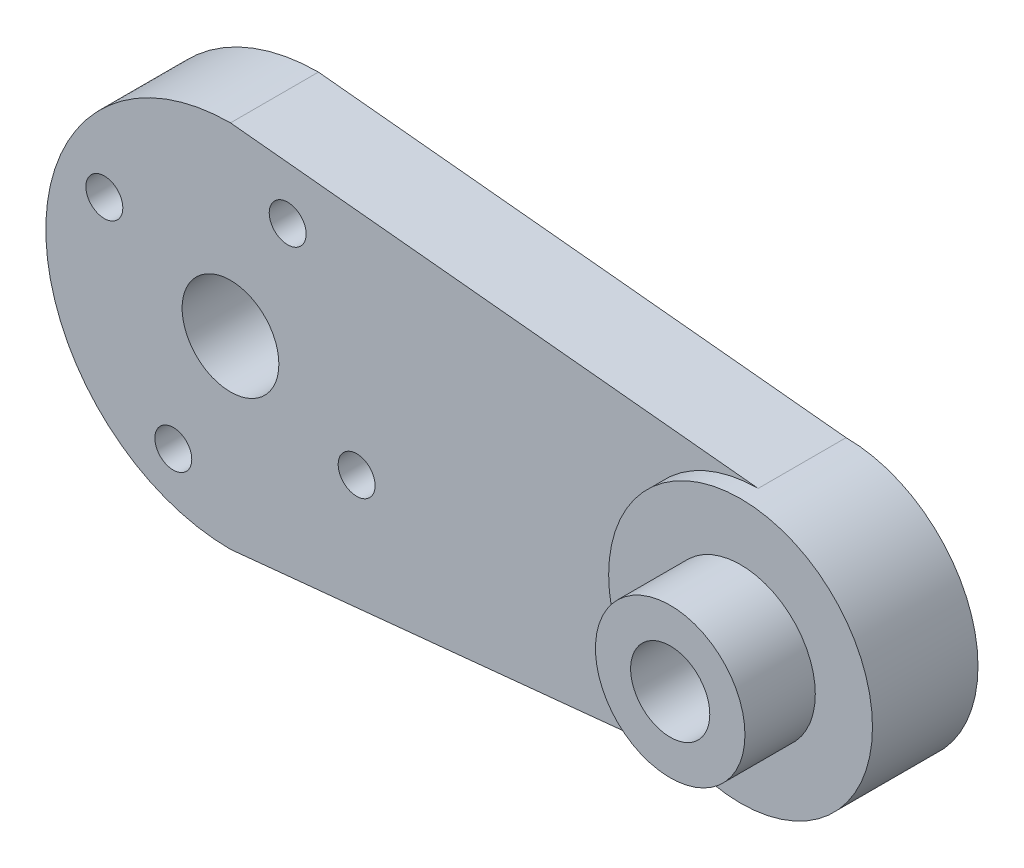
from build123d import *

# Parameters (mm, degrees)
SKETCH_1_R           = 2.75
EXTRUDE_1_DEPTH      = 5
SKETCH_2_R           = 4.250000000000005
EXTRUDE_2_DEPTH      = 5
SKETCH_3_R           = 2.250000000000002
CUT_EXTRUDE_1_DEPTH  = 40.00000000000001
HOLE_WIZARD_M1_8_1_D = 2.1
SKETCH_8_R           = 7.499999999835785
SKETCH_8_R_2         = 2.249999999836049
EXTRUDE_3_DEPTH      = 1


with BuildPart() as part:
    # 스케치1 → 보스-돌출1 (new body)
    with BuildSketch(Plane.XY):
        with BuildLine():
            Line((2.51e-15, 10.5), (30, 7.5))
            ThreePointArc((30, 7.5), (37.5, 0), (30, -7.5))
            Line((30, -7.5), (2.51e-15, -10.5))
            ThreePointArc((2.51e-15, -10.5), (-10.5, 1.29e-15), (2.51e-15, 10.5))
        make_face()
        Circle(SKETCH_1_R, mode=Mode.SUBTRACT)
    extrude(amount=EXTRUDE_1_DEPTH)

    # 스케치2 → 보스-돌출2 (add)
    with BuildSketch(Plane.XY.offset(5)):
        with Locations((30, 0)):
            Circle(SKETCH_2_R)
    extrude(amount=EXTRUDE_2_DEPTH)

    # 스케치3 → 컷-돌출1 (cut)
    with BuildSketch(Plane.XY.offset(10)):
        with Locations((30, 0)):
            Circle(SKETCH_3_R)
    extrude(amount=-CUT_EXTRUDE_1_DEPTH, mode=Mode.SUBTRACT)

    # M1.8 여유 구멍1 (through all)
    with Locations(Plane(origin=(0, 0, 0), x_dir=(-1, 0, 0), z_dir=(0, 0, -1))):
        with Locations((-7.172291773, -3.251754556), (3.251754556, -7.172291774), (7.172291774, 3.251754554), (-3.251754555, 7.172291773)):
            Hole(HOLE_WIZARD_M1_8_1_D / 2)

    # 스케치8 → 보스-돌출3 (add)
    with BuildSketch(Plane.XY.offset(5)):
        with Locations(Location((30.000000000162284, 3.18634e-11, 0), (0, 0, 269.999999996))):
            Circle(SKETCH_8_R)
        with Locations((30.000000000162284, 3.18634e-11)):
            Circle(SKETCH_8_R_2, mode=Mode.SUBTRACT)
    extrude(amount=EXTRUDE_3_DEPTH)


solid = part.part
